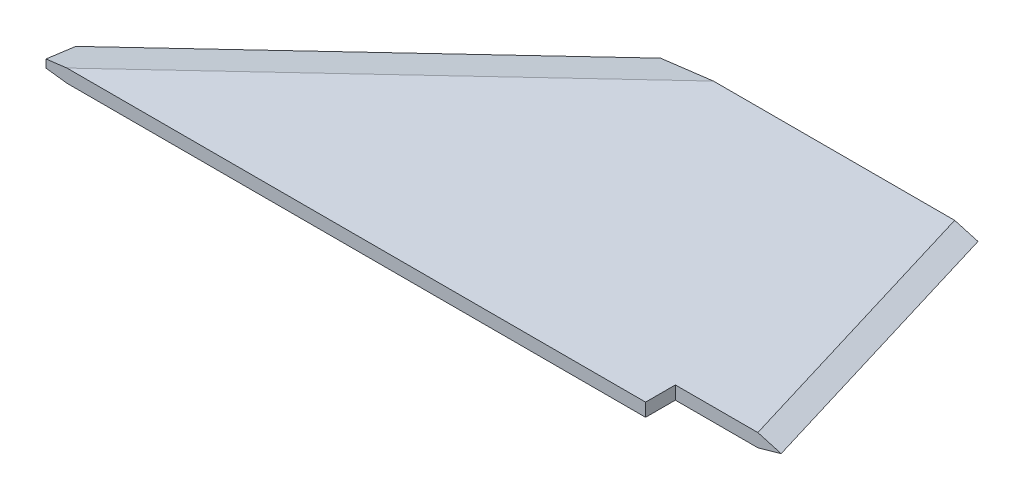
from build123d import *

# Parameters (mm, degrees)
SKETCH2_W               = 215.9
SKETCH2_H               = 10.7188
BOSS_EXTRUDE1_DEPTH     = 4.7498
CUT_EXTRUDE1_DEPTH      = 127
CUT_EXTRUDE2_DEPTH      = 184.509479274
CUT_EXTRUDE2_DEPTH_BACK = 184.509479274


with BuildPart() as part:
    # Sketch2 → Boss-Extrude1 (new body)
    with BuildSketch(Plane(origin=(0, 0, 0), x_dir=(1, 0, 0), z_dir=(0, 1, 0))):
        Polygon((108.966, 101.612438876), (0, 0), (215.9, 0), (254, 0), (223.266, 101.612438876), align=None)
        with Locations((107.95, -5.3594)):
            Rectangle(SKETCH2_W, SKETCH2_H)
    extrude(amount=BOSS_EXTRUDE1_DEPTH)

    # Sketch11 → Cut-Extrude1 (cut)
    with BuildSketch(Plane(origin=(21.289272777, 0, 70.386377589), x_dir=(-0.9571749920693967, 0, 0.2895099904268422), z_dir=(-0.2895099904268422, 0, -0.9571749920693967))):
        Polygon((-243.122447986, 2.3749), (-235.083929839, 4.7498), (-235.083929839, 6.735693681), (-246.008613283, 6.735693681), (-246.008613283, -1.683735196), (-235.083929839, -1.683735196), (-235.083929839, 0), align=None)
    extrude(amount=CUT_EXTRUDE1_DEPTH, mode=Mode.SUBTRACT)

    # Sketch9 → Cut-Extrude2 (cut, two sides: drawn at the far end of the back side and taken through both)
    with BuildSketch(Plane(origin=(108.966, 0, -101.612438876), x_dir=(0.6819983600624973, 0, 0.7313537016191718), z_dir=(-0.7313537016191718, 0, 0.6819983600624973)).offset(-CUT_EXTRUDE2_DEPTH_BACK)):
        Polygon((0, 2.3749), (12.992733122, 0), (12.992733122, -1.975315997), (-2.377492565, -1.975315997), (-2.377492565, 7.448660166), (12.992733122, 7.448660166), (12.992733122, 4.7498), align=None)
    extrude(amount=CUT_EXTRUDE2_DEPTH + CUT_EXTRUDE2_DEPTH_BACK, mode=Mode.SUBTRACT)


solid = part.part
